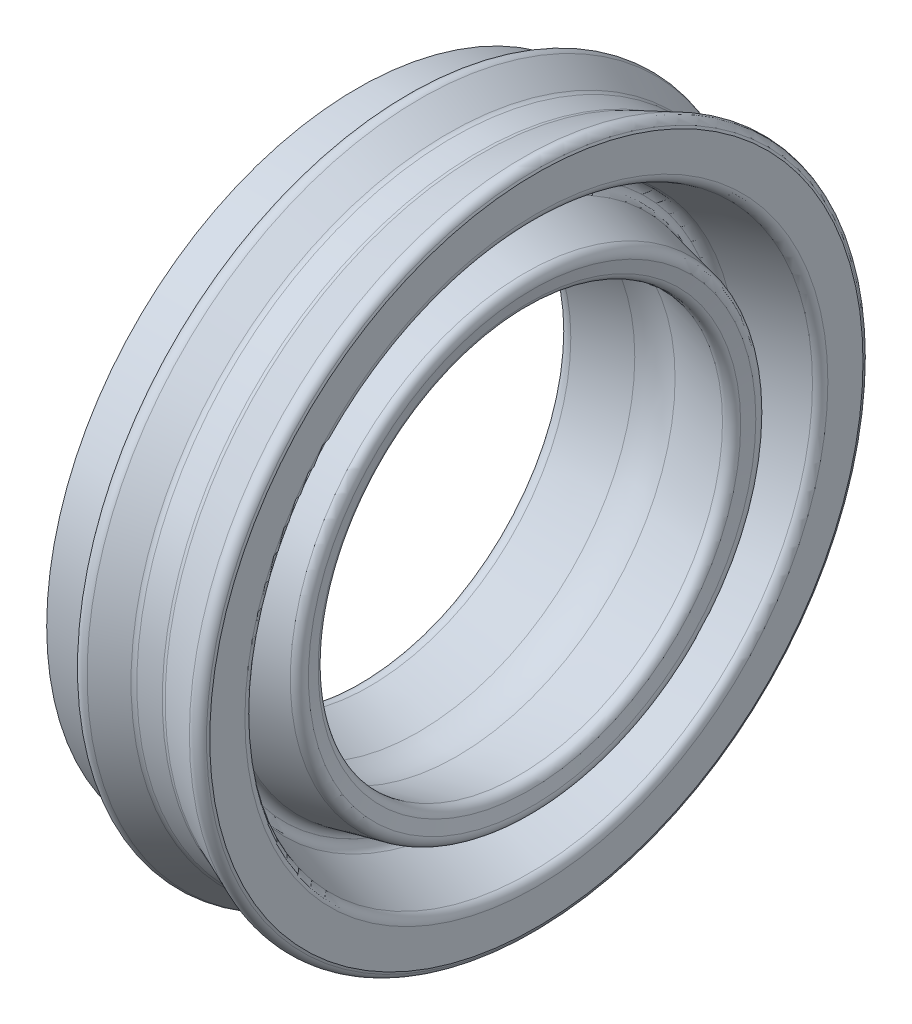
from build123d import *


with BuildPart() as part:
    # Croquis1 → Revolución1 (revolve)
    with BuildSketch(Plane(origin=(0, 0, 0), x_dir=(1, 0, 0), z_dir=(0, 1, 0))):
        with BuildLine():
            Line((-2.152543458, 8.367001057), (-1.091652238, 8.367001057))
            Line((-1.091652238, 8.367001057), (-0.805015592, 8.872830433))
            ThreePointArc((-0.805015592, 8.872830433), (-0.654156559, 8.99053007), (-0.464256902, 8.967082837))
            Line((-0.464256902, 8.967082837), (0.291448947, 8.538849522))
            ThreePointArc((0.291448947, 8.538849522), (0.350969785, 8.51461514), (0.41470209, 8.506355069))
            Line((0.41470209, 8.506355069), (1.100583515, 8.506355069))
            ThreePointArc((1.100583515, 8.506355069), (1.149709187, 8.511229247), (1.19691928, 8.525661722))
            Line((1.19691928, 8.525661722), (2.318440191, 8.994000215))
            ThreePointArc((2.318440191, 8.994000215), (2.509781113, 8.994551371), (2.645469303, 8.859642633))
            Line((2.645469303, 8.859642633), (2.671066503, 8.798345524))
            Line((2.671066503, 8.798345524), (2.671066503, 7.851359316))
            ThreePointArc((2.671066503, 7.851359316), (2.622572122, 7.703388084), (2.495902619, 7.612823039))
            Line((2.495902619, 7.612823039), (0.924902945, 7.119952458))
            ThreePointArc((0.924902945, 7.119952458), (0.798233442, 7.029387412), (0.749739061, 6.88141618))
            Line((0.749739061, 6.88141618), (0.749739061, 6.880134929))
            ThreePointArc((0.749739061, 6.880134929), (0.804870391, 6.723526495), (0.945948672, 6.635990312))
            Line((0.945948672, 6.635990312), (2.365955403, 6.323131833))
            ThreePointArc((2.365955403, 6.323131833), (2.522836878, 6.213587982), (2.556309632, 6.025196827))
            Line((2.556309632, 6.025196827), (2.482880141, 5.69191396))
            ThreePointArc((2.482880141, 5.69191396), (2.372552449, 5.534533728), (2.183132023, 5.50196627))
            Line((2.183132023, 5.50196627), (0.527386144, 5.879688408))
            ThreePointArc((0.527386144, 5.879688408), (0.002863497, 5.928195345), (-0.516130794, 5.838074006))
            Line((-0.516130794, 5.838074006), (-1.827707342, 5.426592383))
            ThreePointArc((-1.827707342, 5.426592383), (-2.05051469, 5.463623042), (-2.152543458, 5.665128661))
            Line((-2.152543458, 5.665128661), (-2.152543458, 6.085759427))
            ThreePointArc((-2.152543458, 6.085759427), (-2.104049077, 6.233730659), (-1.977379574, 6.324295705))
            Line((-1.977379574, 6.324295705), (-0.590605768, 6.759369004))
            Line((-0.590605768, 6.759369004), (-0.590605768, 6.814998197))
            ThreePointArc((-0.590605768, 6.814998197), (-0.663829073, 6.991774892), (-0.840605768, 7.064998197))
            Line((-0.840605768, 7.064998197), (-2.152543458, 7.064998197))
            Line((-2.152543458, 7.064998197), (-2.152543458, 8.367001057))
        make_face()
    revolve(axis=Axis((0, 0, 0), (-1, 0, 0)))


solid = part.part
